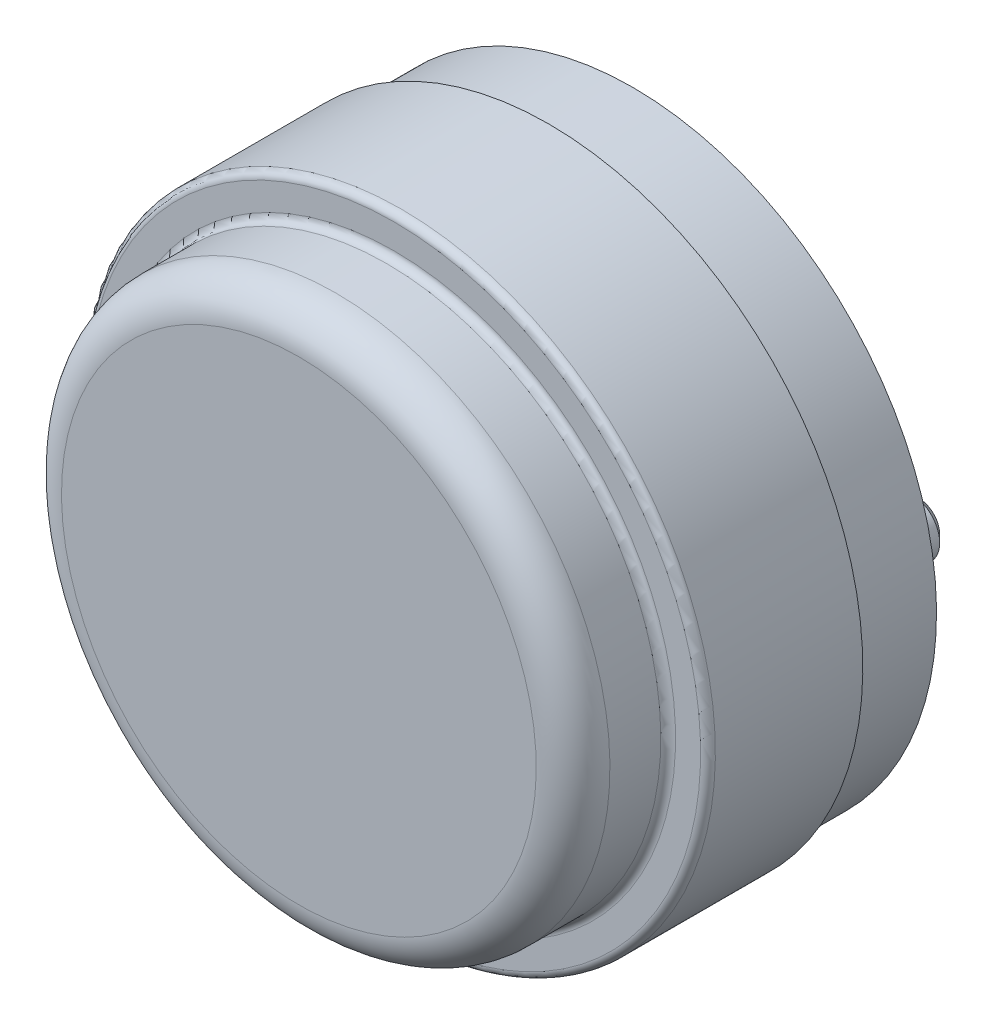
from build123d import *

# Parameters (mm, degrees)
SKETCH3_R      = 0.97155
EXTRUDE2_DEPTH = 2.41
CHAMFER1_SIZE  = 0.25


with BuildPart() as part:
    # Sketch2 → Revolve1 (revolve)
    with BuildSketch(Plane(origin=(0, 0, 0), x_dir=(0, 0, -1), z_dir=(1, 0, 0))):
        with BuildLine():
            Line((-7.62, 0), (-11.5062, 0))
            Line((-11.5062, 0), (-11.5062, 8.178792884))
            ThreePointArc((-11.5062, 8.178792884), (-11.134225612, 9.076818496), (-10.2362, 9.448792884))
            Line((-10.2362, 9.448792884), (-8.483598247, 9.448792884))
            ThreePointArc((-8.483598247, 9.448792884), (-8.303993125, 9.523187762), (-8.229598247, 9.702792884))
            Line((-8.229598247, 9.702792884), (-8.229598247, 10.566392884))
            ThreePointArc((-8.229598247, 10.566392884), (-8.15520337, 10.745998007), (-7.975598247, 10.820392884))
            Line((-7.975598247, 10.820392884), (-2.895598247, 10.820392884))
            Line((-2.895598247, 10.820392884), (-2.895598247, 10.464792884))
            Line((-2.895598247, 10.464792884), (0, 10.464792884))
            Line((0, 10.464792884), (0, 5.08))
            Line((0, 5.08), (-7.62, 5.08))
            Line((-7.62, 5.08), (-7.62, 0))
        make_face()
    revolve(axis=Axis((0, 0, 0), (0, 0, 1)))

    # Sketch3 → Extrude2 (add)
    with BuildSketch(Plane.XY):
        with Locations((7.4422, 0)):
            Circle(SKETCH3_R)
        with Locations(Location((-7.4422, 0, 0), (0, 0, 90))):
            Circle(SKETCH3_R)
    extrude(amount=-EXTRUDE2_DEPTH)

    # Chamfer1
    chamfer1_edges = [part.edges().sort_by_distance(p)[0] for p in [
        (6.47065, 0, -2.41),
        (-7.4422, -0.97155, -2.41),
    ]]
    chamfer(chamfer1_edges, length=CHAMFER1_SIZE)


solid = part.part
